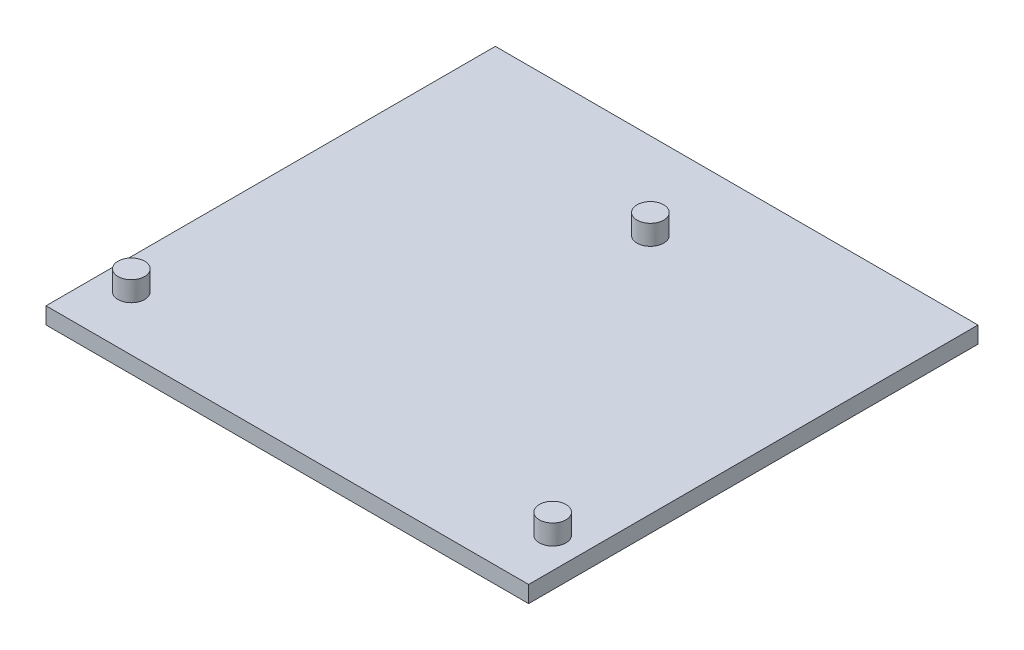
from build123d import *

# Parameters (mm, degrees)
SKETCH1_W           = 29
SKETCH1_H           = 27
BOSS_EXTRUDE1_DEPTH = 1
SKETCH2_R           = 0.8
BOSS_EXTRUDE2_DEPTH = 1.2


with BuildPart() as part:
    # Sketch1 → Boss-Extrude1 (new body)
    with BuildSketch(Plane(origin=(0, 0, 0), x_dir=(1, 0, 0), z_dir=(0, 1, 0))):
        Rectangle(SKETCH1_W, SKETCH1_H)
    extrude(amount=BOSS_EXTRUDE1_DEPTH)

    # Sketch2 → Boss-Extrude2 (add)
    with BuildSketch(Plane(origin=(0, 1, 0), x_dir=(1, 0, 0), z_dir=(0, 1, 0))):
        with Locations(Location((0, 8.314815344, 0), (0, 0, 90))):
            Circle(SKETCH2_R)
        with Locations(Location((-12.66, -10.215184656, 0), (0, 0, 90))):
            Circle(SKETCH2_R)
        with Locations(Location((12.66, -10.215184656, 0), (0, 0, 90))):
            Circle(SKETCH2_R)
    extrude(amount=BOSS_EXTRUDE2_DEPTH)


solid = part.part
